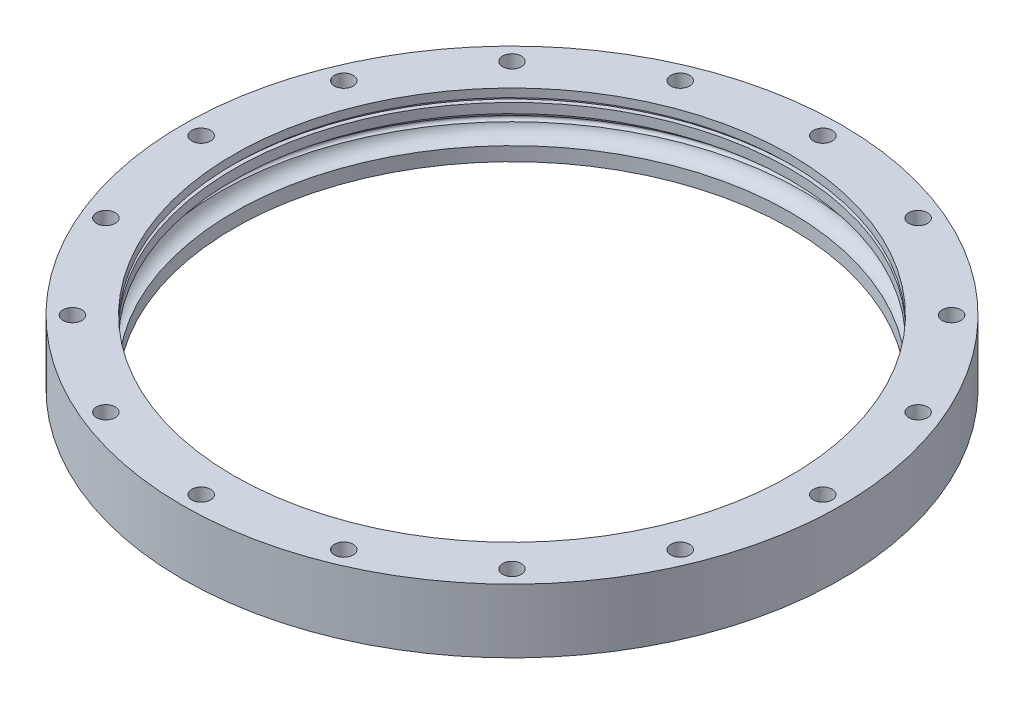
from build123d import *

# Parameters (mm, degrees)
ESQUISSE2_R             = 6.75
ENL_V_MAT_EXTRU_1_DEPTH = 340.011061766


with BuildPart() as part:
    # Esquisse1 → Révolution1 (revolve)
    with BuildSketch(Plane.XY, mode=Mode.PRIVATE) as r_volution1_sk:
        with BuildLine():
            Line((-237.5, 0), (-237.5, 46))
            Line((-237.5, 46), (-200.5, 46))
            Line((-200.5, 46), (-200.5, 40))
            Line((-200.5, 40), (-203.5, 40))
            Line((-203.5, 40), (-203.5, 37))
            Line((-203.5, 37), (-200.5, 37))
            Line((-200.5, 37), (-200.5, 30))
            ThreePointArc((-200.5, 30), (-206.833651811, 27.738530528), (-210.302631579, 21.976970948))
            ThreePointArc((-210.302631579, 21.976970948), (-212, 20), (-210.302631579, 18.023029052))
            ThreePointArc((-210.302631579, 18.023029052), (-206.833651811, 12.261469472), (-200.5, 10))
            Line((-200.5, 10), (-200.5, 0))
            Line((-200.5, 0), (-237.5, 0))
        make_face()
    revolve(r_volution1_sk.sketch.rotate(Axis((0, 46, 0), (0, -1, 0)), 270), axis=Axis((0, 46, 0), (0, -1, 0)))

    # Esquisse2 → Enlèv. mat.-Extru.1 (cut, through all)
    with BuildSketch(Plane(origin=(0, 46, 0), x_dir=(1, 0, 0), z_dir=(0, 1, 0))):
        with Locations(Location((-224, 0, 0), (0, 0, 270))):
            Circle(ESQUISSE2_R)
        with Locations(Location((-206.949015283, 85.72108885, 0), (0, 0, 270))):
            Circle(ESQUISSE2_R)
        with Locations(Location((-158.391918986, 158.391918986, 0), (0, 0, 270))):
            Circle(ESQUISSE2_R)
        with Locations(Location((-85.72108885, 206.949015283, 0), (0, 0, 270))):
            Circle(ESQUISSE2_R)
        with Locations(Location((0, 224, 0), (0, 0, 270))):
            Circle(ESQUISSE2_R)
        with Locations(Location((85.72108885, 206.949015283, 0), (0, 0, 270))):
            Circle(ESQUISSE2_R)
        with Locations(Location((158.391918986, 158.391918986, 0), (0, 0, 270))):
            Circle(ESQUISSE2_R)
        with Locations(Location((206.949015283, 85.72108885, 0), (0, 0, 270))):
            Circle(ESQUISSE2_R)
        with Locations(Location((224, 0, 0), (0, 0, 270))):
            Circle(ESQUISSE2_R)
        with Locations(Location((206.949015283, -85.72108885, 0), (0, 0, 270))):
            Circle(ESQUISSE2_R)
        with Locations(Location((158.391918986, -158.391918986, 0), (0, 0, 270))):
            Circle(ESQUISSE2_R)
        with Locations(Location((85.72108885, -206.949015283, 0), (0, 0, 270))):
            Circle(ESQUISSE2_R)
        with Locations(Location((0, -224, 0), (0, 0, 270))):
            Circle(ESQUISSE2_R)
        with Locations(Location((-85.72108885, -206.949015283, 0), (0, 0, 270))):
            Circle(ESQUISSE2_R)
        with Locations(Location((-158.391918986, -158.391918986, 0), (0, 0, 270))):
            Circle(ESQUISSE2_R)
        with Locations(Location((-206.949015283, -85.72108885, 0), (0, 0, 270))):
            Circle(ESQUISSE2_R)
    extrude(amount=-ENL_V_MAT_EXTRU_1_DEPTH, mode=Mode.SUBTRACT)


solid = part.part
